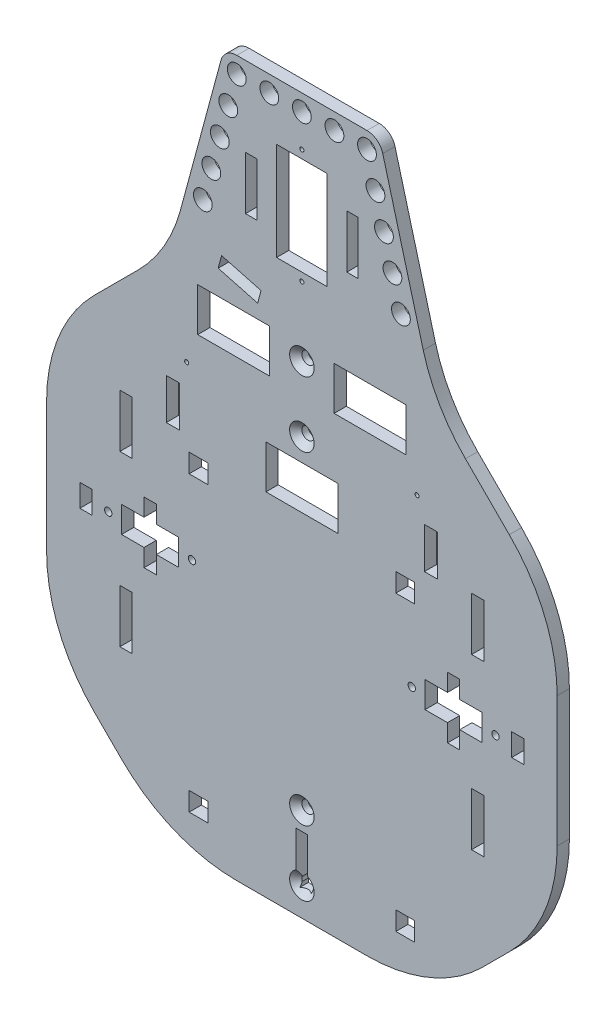
from build123d import *

# Parameters (mm, degrees)
SKICA1_R                 = 0.5
SKICA1_R_2               = 2.3
SKICA1_R_3               = 0.9
SKICA1_W                 = 3
SKICA1_H                 = 13
SKICA1_H_2               = 5.5
SKICA1_W_2               = 17.6
SKICA1_H_3               = 10.6
SKICA1_W_3               = 12.4
SKICA1_H_4               = 24
SKICA1_W_4               = 2.8
SKICA1_W_5               = 3.2
SKICA1_H_5               = 10
SKICA1_W_6               = 4.6
SKICA1_H_6               = 4.6
P_IDAT_VYSUNUT_M1_DEPTH  = 3
SKICA2_R                 = 1.5
ODEBRAT_VYSUNUT_M1_DEPTH = 3
ZKOSEN_1_SIZE            = 1.5
ZAOBLIT1_R               = 40
ZAOBLIT2_R               = 4
SKICA3_R                 = 0.5
SKICA3_W                 = 2.8
SKICA3_H                 = 13
ODEBRAT_VYSUNUT_M2_DEPTH = 129.730338305


with BuildPart() as part:
    # Skica1 → Přidat vysunutím1 (new body)
    with BuildSketch(Plane.XY):
        Polygon((-62.5, -32.5), (-62.5, 32.5), (-32.5, 62.5), (-19.003438856, 112.5), (19.003438856, 112.5), (32.5, 62.5), (62.5, 32.5), (62.5, -32.5), (32.5, -62.5), (-32.5, -62.5), align=None)
        with Locations((0, 100.5)):
            Circle(SKICA1_R, mode=Mode.SUBTRACT)
        with Locations(Location((0, 72.5, 0), (0, 0, 180))):
            Circle(SKICA1_R, mode=Mode.SUBTRACT)
        with Locations((0, 108.5)):
            Circle(SKICA1_R_2, mode=Mode.SUBTRACT)
        with Locations((7.97, 108.5)):
            Circle(SKICA1_R_2, mode=Mode.SUBTRACT)
        with Locations((15.94, 108.5)):
            Circle(SKICA1_R_2, mode=Mode.SUBTRACT)
        with Locations(Location((-15.94, 108.5, 0), (0, 0, 180))):
            Circle(SKICA1_R_2, mode=Mode.SUBTRACT)
        with Locations(Location((-7.97, 108.5, 0), (0, 0, 180))):
            Circle(SKICA1_R_2, mode=Mode.SUBTRACT)
        with Locations(Location((-18.017013584, 100.805397049, 0), (0, 0, 180))):
            Circle(SKICA1_R_2, mode=Mode.SUBTRACT)
        with Locations((-20.094027168, 93.110794098)):
            Circle(SKICA1_R_2, mode=Mode.SUBTRACT)
        with Locations((-22.171040752, 85.416191147)):
            Circle(SKICA1_R_2, mode=Mode.SUBTRACT)
        with Locations((-24.248054336, 77.721588196)):
            Circle(SKICA1_R_2, mode=Mode.SUBTRACT)
        with Locations(Location((24.248054336, 77.721588196, 0), (0, 0, 180))):
            Circle(SKICA1_R_2, mode=Mode.SUBTRACT)
        with Locations(Location((22.171040752, 85.416191147, 0), (0, 0, 180))):
            Circle(SKICA1_R_2, mode=Mode.SUBTRACT)
        with Locations(Location((20.094027168, 93.110794098, 0), (0, 0, 180))):
            Circle(SKICA1_R_2, mode=Mode.SUBTRACT)
        with Locations((18.017013584, 100.805397049)):
            Circle(SKICA1_R_2, mode=Mode.SUBTRACT)
        with Locations((47.397781356, 0)):
            Circle(SKICA1_R_3, mode=Mode.SUBTRACT)
        with Locations(Location((26.897781356, 0, 0), (0, 0, 180))):
            Circle(SKICA1_R_3, mode=Mode.SUBTRACT)
        with Locations(Location((-47.397781356, 0, 0), (0, 0, 180))):
            Circle(SKICA1_R_3, mode=Mode.SUBTRACT)
        with Locations((-26.897781356, 0)):
            Circle(SKICA1_R_3, mode=Mode.SUBTRACT)
        Polygon((-44.147781356, 3.2), (-38.647781356, 3.2), (-38.647781356, 7.5), (-35.647781356, 7.5), (-35.647781356, 3.2), (-30.147781356, 3.2), (-30.147781356, -3.2), (-35.647781356, -3.2), (-35.647781356, -7.5), (-38.647781356, -7.5), (-38.647781356, -3.2), (-44.147781356, -3.2), align=None, mode=Mode.SUBTRACT)
        with Locations((-43.047781356, 20.7)):
            Rectangle(SKICA1_W, SKICA1_H, mode=Mode.SUBTRACT)
        with Locations((-52.847781356, 0)):
            Rectangle(SKICA1_W, SKICA1_H_2, mode=Mode.SUBTRACT)
        with Locations((-43.047781356, -20.7)):
            Rectangle(SKICA1_W, SKICA1_H, mode=Mode.SUBTRACT)
        Polygon((38.647781356, -7.5), (35.647781356, -7.5), (35.647781356, -3.2), (30.147781356, -3.2), (30.147781356, 3.2), (35.647781356, 3.2), (35.647781356, 7.5), (38.647781356, 7.5), (38.647781356, 3.2), (44.147781356, 3.2), (44.147781356, -3.2), (38.647781356, -3.2), align=None, mode=Mode.SUBTRACT)
        with Locations((52.847781356, 0)):
            Rectangle(SKICA1_W, SKICA1_H_2, mode=Mode.SUBTRACT)
        with Locations((43.047781356, 20.7)):
            Rectangle(SKICA1_W, SKICA1_H, mode=Mode.SUBTRACT)
        with Locations((43.047781356, -20.7)):
            Rectangle(SKICA1_W, SKICA1_H, mode=Mode.SUBTRACT)
        with Locations((16.7, 53.8)):
            Rectangle(SKICA1_W_2, SKICA1_H_3, mode=Mode.SUBTRACT)
        with Locations((0, 28.8)):
            Rectangle(SKICA1_W_2, SKICA1_H_3, mode=Mode.SUBTRACT)
        with Locations((-16.7, 53.8)):
            Rectangle(SKICA1_W_2, SKICA1_H_3, mode=Mode.SUBTRACT)
        with Locations((0, 86.5)):
            Rectangle(SKICA1_W_3, SKICA1_H_4, mode=Mode.SUBTRACT)
        with Locations((-12.4, 86.5)):
            Rectangle(SKICA1_W_4, SKICA1_H, mode=Mode.SUBTRACT)
        Polygon((-20.487479207, 65.088190451), (-10.828220944, 62.5), (-10, 65.590962644), (-19.659258263, 68.179153095), align=None, mode=Mode.SUBTRACT)
        with Locations((12.4, 86.5)):
            Rectangle(SKICA1_W_4, SKICA1_H, mode=Mode.SUBTRACT)
        with Locations((31.6, 31)):
            Rectangle(SKICA1_W_5, SKICA1_H_5, mode=Mode.SUBTRACT)
        with Locations((-31.6, 31)):
            Rectangle(SKICA1_W_5, SKICA1_H_5, mode=Mode.SUBTRACT)
        with Locations((25.3, 20.23)):
            Rectangle(SKICA1_W_6, SKICA1_H_6, mode=Mode.SUBTRACT)
        with Locations((25.3, -51.5)):
            Rectangle(SKICA1_W_6, SKICA1_H_6, mode=Mode.SUBTRACT)
        with Locations((-25.3, -51.5)):
            Rectangle(SKICA1_W_6, SKICA1_H_6, mode=Mode.SUBTRACT)
        with Locations((-25.3, 20.23)):
            Rectangle(SKICA1_W_6, SKICA1_H_6, mode=Mode.SUBTRACT)
    extrude(amount=P_IDAT_VYSUNUT_M1_DEPTH)

    # Skica2 → Odebrat vysunutím1 (cut)
    with BuildSketch(Plane.XY):
        with Locations(Location((0, 39.6, 0), (0, 0, 180))):
            Circle(SKICA2_R)
        with Locations(Location((0, 55.6, 0), (0, 0, 180))):
            Circle(SKICA2_R)
        with Locations(Location((0, -55.6, 0), (0, 0, 180))):
            Circle(SKICA2_R)
        with Locations(Location((0, -39.6, 0), (0, 0, 180))):
            Circle(SKICA2_R)
    extrude(amount=ODEBRAT_VYSUNUT_M1_DEPTH, mode=Mode.SUBTRACT)

    # Zkosení1
    zkosen_1_edges = [part.edges().sort_by_distance(p)[0] for p in [
        (1.5, 55.6, 3),
        (1.5, -55.6, 3),
        (1.5, -39.6, 3),
        (1.5, 39.6, 3),
    ]]
    chamfer(zkosen_1_edges, length=ZKOSEN_1_SIZE)

    # Zaoblit1
    zaoblit1_edges = [part.edges().sort_by_distance(p)[0] for p in [
        (-62.5, -32.5, 1.5),
        (-62.5, 32.5, 1.5),
        (-32.5, 62.5, 1.5),
        (32.5, 62.5, 1.5),
        (62.5, 32.5, 1.5),
        (62.5, -32.5, 1.5),
        (32.5, -62.5, 1.5),
        (-32.5, -62.5, 1.5),
    ]]
    fillet(zaoblit1_edges, radius=ZAOBLIT1_R)

    # Zaoblit2
    zaoblit2_edges = [part.edges().sort_by_distance(p)[0] for p in [
        (-19.003438856, 112.5, 1.5),
        (19.003438856, 112.5, 1.5),
    ]]
    fillet(zaoblit2_edges, radius=ZAOBLIT2_R)

    # Skica3 → Odebrat vysunutím2 (cut, through all)
    with BuildSketch(Plane.XY.offset(3)):
        with Locations((-28.2, 41.3)):
            Circle(SKICA3_R)
        with Locations(Location((28.2, 41.3, 0), (0, 0, 180))):
            Circle(SKICA3_R)
        with Locations((0, -50.6)):
            Rectangle(SKICA3_W, SKICA3_H)
    extrude(amount=-ODEBRAT_VYSUNUT_M2_DEPTH, mode=Mode.SUBTRACT)


solid = part.part
